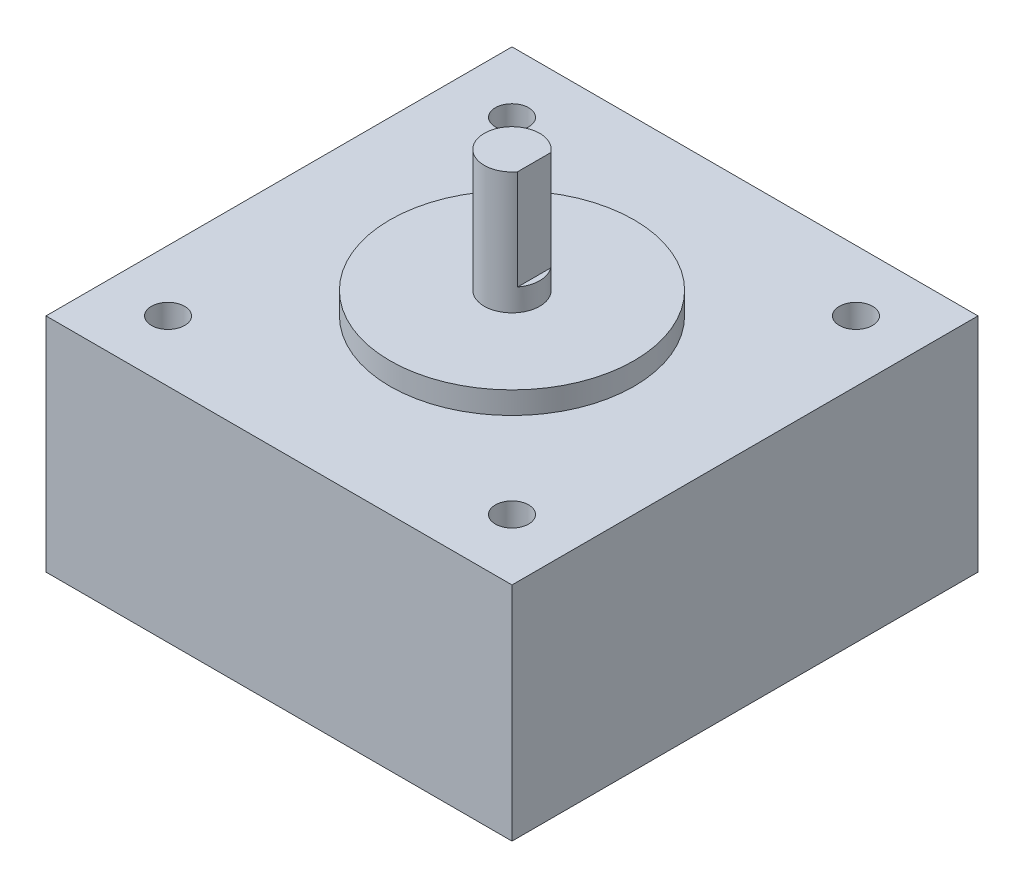
from build123d import *

# Parameters (mm, degrees)
SKETCH_1_W          = 42
SKETCH_1_H          = 42
SKETCH_1_R          = 1.5
EXTRUDE_1_DEPTH     = 20
SKETCH_2_R          = 11
EXTRUDE_2_DEPTH     = 2
SKETCH_3_R          = 2.5
EXTRUDE_3_DEPTH     = 11
CUT_EXTRUDE_START   = -9
CUT_EXTRUDE_1_DEPTH = 9


with BuildPart() as part:
    # 草图1 → 凸台-拉伸1 (new body)
    with BuildSketch(Plane(origin=(0, 0, 0), x_dir=(1, 0, 0), z_dir=(0, 1, 0))):
        with Locations((21, 21)):
            Rectangle(SKETCH_1_W, SKETCH_1_H)
        with Locations(Location((5.5, 5.5, 0), (0, 0, 270))):
            Circle(SKETCH_1_R, mode=Mode.SUBTRACT)
        with Locations(Location((36.5, 5.5, 0), (0, 0, 270))):
            Circle(SKETCH_1_R, mode=Mode.SUBTRACT)
        with Locations(Location((36.5, 36.5, 0), (0, 0, 270))):
            Circle(SKETCH_1_R, mode=Mode.SUBTRACT)
        with Locations(Location((5.5, 36.5, 0), (0, 0, 270))):
            Circle(SKETCH_1_R, mode=Mode.SUBTRACT)
    extrude(amount=EXTRUDE_1_DEPTH)

    # 草图2 → 凸台-拉伸2 (add)
    with BuildSketch(Plane(origin=(0, 20, 0), x_dir=(1, 0, 0), z_dir=(0, 1, 0))):
        with Locations(Location((21, 21, 0), (0, 0, 270))):
            Circle(SKETCH_2_R)
    extrude(amount=EXTRUDE_2_DEPTH)

    # 草图3 → 凸台-拉伸3 (add)
    with BuildSketch(Plane(origin=(0, 22, 0), x_dir=(1, 0, 0), z_dir=(0, 1, 0))):
        with Locations(Location((21, 21, 0), (0, 0, 270))):
            Circle(SKETCH_3_R)
    extrude(amount=EXTRUDE_3_DEPTH)

    # 草图4 → 切除-拉伸1 (cut)
    with BuildSketch(Plane(origin=(0, 33, 0), x_dir=(1, 0, 0), z_dir=(0, 1, 0)).offset(CUT_EXTRUDE_START)):
        with BuildLine():
            Line((23, 22.5), (23, 21))
            Line((23, 21), (23, 19.5))
            ThreePointArc((23, 19.5), (23.371708245, 20.209430585), (23.5, 21))
            ThreePointArc((23.5, 21), (23.371708245, 21.790569415), (23, 22.5))
        make_face()
    extrude(amount=CUT_EXTRUDE_1_DEPTH, mode=Mode.SUBTRACT)


solid = part.part
